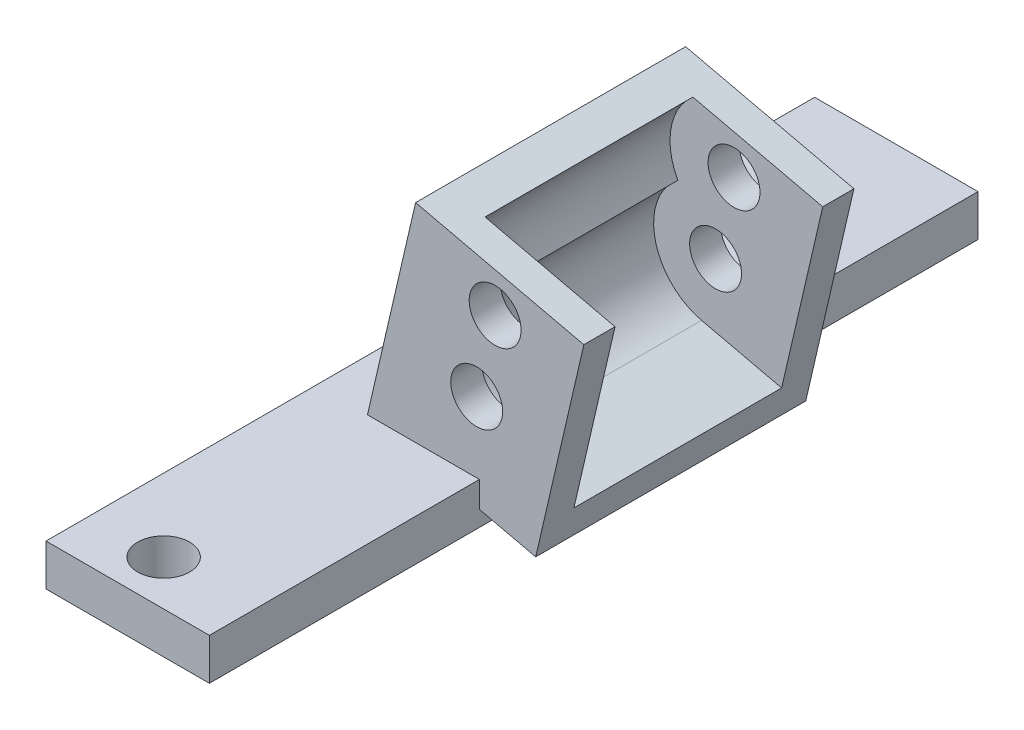
from build123d import *

# Parameters (mm, degrees)
BOSS_EXTRUDE1_DEPTH     = 25.4
SKETCH2_R               = 3.175
BOSS_EXTRUDE3_DEPTH     = 3.81
BOSS_EXTRUDE4_START     = 3.81
SKETCH3_R               = 3.175
BOSS_EXTRUDE4_DEPTH     = 3.81
SKETCH4_W               = 19.976191583
SKETCH4_H               = 93.98
BOSS_EXTRUDE5_DEPTH     = 5.08
CUT_EXTRUDE1_DEPTH      = 5.08
CUT_EXTRUDE1_DEPTH_BACK = 381.820097899
SKETCH5_R               = 3.175


with BuildPart() as part:
    # Sketch1 → Boss-Extrude1 (new body)
    with BuildSketch(Plane.XY):
        with BuildLine():
            Line((-348.791316574, 206.904032246), (-347.931840304, 210.615824339))
            Line((-347.931840304, 210.615824339), (-357.71784023, 212.881801123))
            ThreePointArc((-357.71784023, 212.881801123), (-360.881852793, 214.462416261), (-362.982664296, 217.307747657))
            ThreePointArc((-362.982664296, 217.307747657), (-363.332122594, 222.183147168), (-360.629697113, 226.256050065))
            ThreePointArc((-360.629697113, 226.256050065), (-361.446766946, 231.453900041), (-358.789055407, 235.995025106))
            Line((-358.789055407, 235.995025106), (-363.476973871, 237.08052628))
            Line((-363.476973871, 237.08052628), (-369.361521397, 211.667123083))
            Line((-369.361521397, 211.667123083), (-348.791316574, 206.904032246))
        make_face()
    extrude(amount=-BOSS_EXTRUDE1_DEPTH)

    # Sketch2 → Boss-Extrude3 (add)
    # profile 1 of 2: a face of its own
    with BuildSketch(Plane(origin=(0, 0, -25.4), x_dir=(-1, 0, 0), z_dir=(0, 0, -1))):
        with BuildLine():
            Line((342.906769048, 232.317435443), (358.789055407, 235.995025106))
            ThreePointArc((358.789055407, 235.995025106), (361.446766946, 231.453900041), (360.629697113, 226.256050065))
            ThreePointArc((360.629697113, 226.256050065), (363.40772554, 218.647103628), (357.71784023, 212.881801123))
            Line((357.71784023, 212.881801123), (347.931840304, 210.615824339))
            Line((347.931840304, 210.615824339), (342.906769048, 232.317435443))
        make_face()
        with Locations(Location((353.754071424, 230, 0), (0, 0, 180))):
            Circle(SKETCH2_R, mode=Mode.SUBTRACT)
        with Locations(Location((356.009914651, 220.257763535, 0), (0, 0, 180))):
            Circle(SKETCH2_R, mode=Mode.SUBTRACT)
    # profile 2 of 2: a face of its own
    with BuildSketch(Plane(origin=(0, 0, -25.4), x_dir=(-1, 0, 0), z_dir=(0, 0, -1))):
        with BuildLine():
            ThreePointArc((360.629697113, 226.256050065), (363.40772554, 218.647103628), (357.71784023, 212.881801123))
            Line((357.71784023, 212.881801123), (347.931840304, 210.615824339))
            Line((347.931840304, 210.615824339), (348.791316574, 206.904032246))
            Line((348.791316574, 206.904032246), (369.361521397, 211.667123083))
            Line((369.361521397, 211.667123083), (363.476973871, 237.08052628))
            Line((363.476973871, 237.08052628), (358.789055407, 235.995025106))
            ThreePointArc((358.789055407, 235.995025106), (361.446766946, 231.453900041), (360.629697113, 226.256050065))
        make_face()
    extrude(amount=BOSS_EXTRUDE3_DEPTH)

    # Sketch3 → Boss-Extrude4 (add)
    # profile 1 of 2: a face of its own
    with BuildSketch(Plane.XY.offset(BOSS_EXTRUDE4_START)):
        with BuildLine():
            Line((-342.906769048, 232.317435443), (-358.789055407, 235.995025106))
            ThreePointArc((-358.789055407, 235.995025106), (-361.446766946, 231.453900041), (-360.629697113, 226.256050065))
            ThreePointArc((-360.629697113, 226.256050065), (-363.40772554, 218.647103628), (-357.71784023, 212.881801123))
            Line((-357.71784023, 212.881801123), (-347.931840304, 210.615824339))
            Line((-347.931840304, 210.615824339), (-342.906769048, 232.317435443))
        make_face()
        with Locations((-356.009914651, 220.257763535)):
            Circle(SKETCH3_R, mode=Mode.SUBTRACT)
        with Locations((-353.754071424, 230)):
            Circle(SKETCH3_R, mode=Mode.SUBTRACT)
    # profile 2 of 2: a face of its own
    with BuildSketch(Plane.XY.offset(BOSS_EXTRUDE4_START)):
        with BuildLine():
            Line((-347.931840304, 210.615824339), (-357.71784023, 212.881801123))
            ThreePointArc((-357.71784023, 212.881801123), (-363.40772554, 218.647103628), (-360.629697113, 226.256050065))
            ThreePointArc((-360.629697113, 226.256050065), (-361.446766946, 231.453900041), (-358.789055407, 235.995025106))
            Line((-358.789055407, 235.995025106), (-363.476973871, 237.08052628))
            Line((-363.476973871, 237.08052628), (-369.361521397, 211.667123083))
            Line((-369.361521397, 211.667123083), (-348.791316574, 206.904032246))
            Line((-348.791316574, 206.904032246), (-347.931840304, 210.615824339))
        make_face()
    extrude(amount=-BOSS_EXTRUDE4_DEPTH)

    # Sketch4 → Boss-Extrude5 (add)
    with BuildSketch(Plane(origin=(0, 211.667123083, 0), x_dir=(1, 0, 0), z_dir=(0, 1, 0))):
        with Locations((-365.660654241, 10.16)):
            Rectangle(SKETCH4_W, SKETCH4_H)
    extrude(amount=-BOSS_EXTRUDE5_DEPTH)

    # Sketch5 → Cut-Extrude1 (cut, two sides: drawn at the far end of the back side and taken through both)
    with BuildSketch(Plane(origin=(0, 211.667123083, 0), x_dir=(1, 0, 0), z_dir=(0, 1, 0)).offset(-CUT_EXTRUDE1_DEPTH_BACK)):
        with Locations(Location((-366.758750033, 43.909082713, 0), (0, 0, 270))):
            Circle(SKETCH5_R)
        with Locations(Location((-366.758750033, -31.331908304, 0), (0, 0, 270))):
            Circle(SKETCH5_R)
    extrude(amount=CUT_EXTRUDE1_DEPTH + CUT_EXTRUDE1_DEPTH_BACK, mode=Mode.SUBTRACT)


solid = part.part
